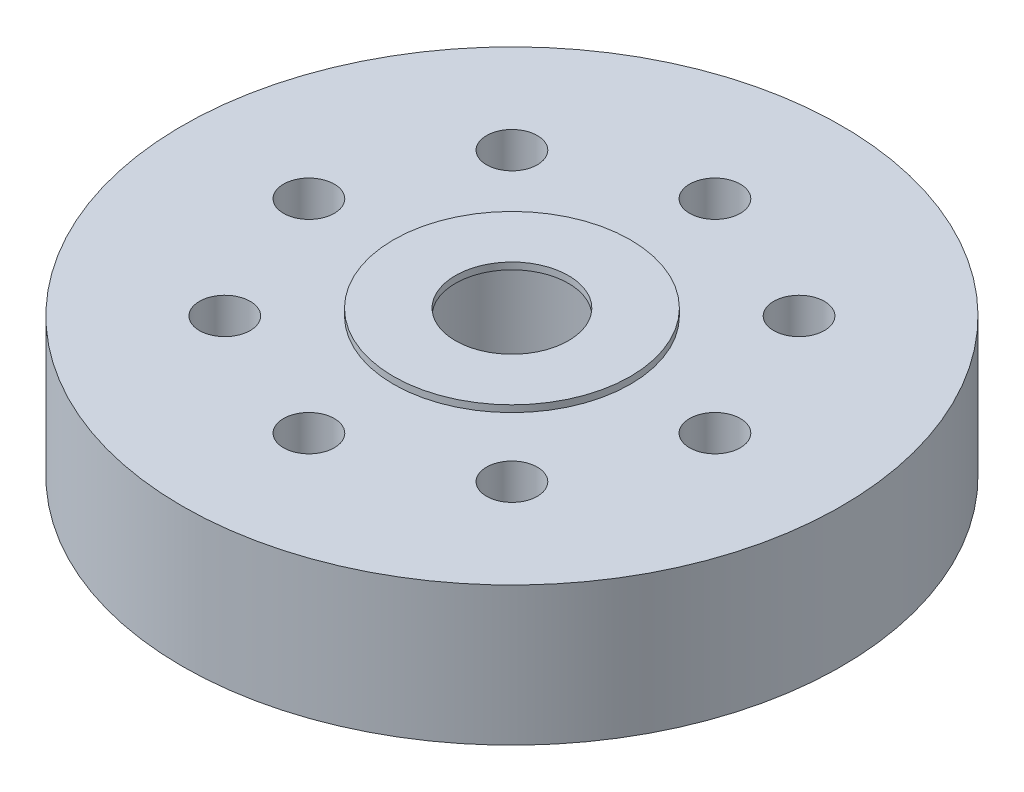
from build123d import *

# Parameters (mm, degrees)
SKETCH1_R        = 9.74
SKETCH1_R_2      = 2.57
MOUNTBODY_DEPTH  = 4.1
SKETCH2_R        = 3.5
SKETCH2_R_2      = 1.67
CAP_DEPTH        = 0.2
SKETCH3_R        = 0.75
SCREWHOLES_DEPTH = 15.371680486


with BuildPart() as part:
    # Sketch1 → MountBody (new body)
    with BuildSketch(Plane(origin=(0, 0, 0), x_dir=(1, 0, 0), z_dir=(0, 1, 0))):
        with Locations(Location((0, 0, 0), (0, 0, 270))):
            Circle(SKETCH1_R)
        with Locations(Location((0, 0, 0), (0, 0, 270))):
            Circle(SKETCH1_R_2, mode=Mode.SUBTRACT)
    extrude(amount=MOUNTBODY_DEPTH)

    # Sketch2 → Cap (add)
    with BuildSketch(Plane(origin=(0, 4.1, 0), x_dir=(1, 0, 0), z_dir=(0, 1, 0))):
        with Locations(Location((0, 0, 0), (0, 0, 270))):
            Circle(SKETCH2_R)
        with Locations(Location((0, 0, 0), (0, 0, 270))):
            Circle(SKETCH2_R_2, mode=Mode.SUBTRACT)
    extrude(amount=CAP_DEPTH)

    # Sketch3 → ScrewHoles (cut, through all)
    with BuildSketch(Plane(origin=(0, 4.1, 0), x_dir=(1, 0, 0), z_dir=(0, 1, 0))):
        with Locations(Location((6, 0, 0), (0, 0, 270))):
            Circle(SKETCH3_R)
        with Locations(Location((4.242640687, -4.242640687, 0), (0, 0, 270))):
            Circle(SKETCH3_R)
        with Locations(Location((0, -6, 0), (0, 0, 270))):
            Circle(SKETCH3_R)
        with Locations(Location((-4.242640687, -4.242640687, 0), (0, 0, 270))):
            Circle(SKETCH3_R)
        with Locations(Location((-6, 0, 0), (0, 0, 270))):
            Circle(SKETCH3_R)
        with Locations(Location((-4.242640687, 4.242640687, 0), (0, 0, 270))):
            Circle(SKETCH3_R)
        with Locations(Location((0, 6, 0), (0, 0, 270))):
            Circle(SKETCH3_R)
        with Locations(Location((4.242640687, 4.242640687, 0), (0, 0, 270))):
            Circle(SKETCH3_R)
    extrude(amount=-SCREWHOLES_DEPTH, mode=Mode.SUBTRACT)


solid = part.part
